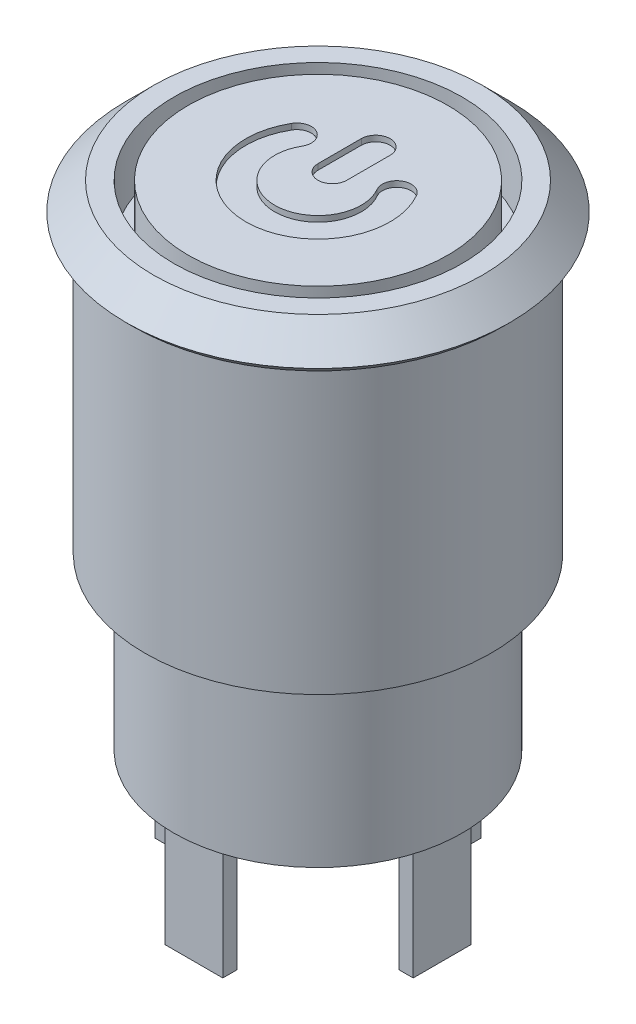
from build123d import *

# Parameters (mm, degrees)
SKETCH_1_R          = 6
EXTRUDE_1_DEPTH     = 10
SKETCH_2_R          = 5.7
SKETCH_3_R          = 6.9
CHAMFER_1_SIZE      = 0.5
CHAMFER_1_SIZE2     = 0.353553391
SKETCH_4_R          = 5
CUT_EXTRUDE_1_DEPTH = 2
SKETCH_5_R          = 4.5
EXTRUDE_2_DEPTH     = 2
CUT_EXTRUDE_2_DEPTH = 0.2
SKETCH_20_R         = 5
EXTRUDE_3_DEPTH     = 5.9
SKETCH_21_W         = 2
SKETCH_21_H         = 0.5
SKETCH_21_W_2       = 2.554126296
SKETCH_21_H_2       = 0.581017117
SKETCH_21_W_3       = 0.5
SKETCH_21_H_3       = 2
SKETCH_21_W_4       = 0.581017117
SKETCH_21_H_4       = 2.554126296
EXTRUDE_4_DEPTH     = 4.2


with BuildPart() as part:
    # 草图1 → 凸台-拉伸1 (new body)
    with BuildSketch(Plane(origin=(0, 0, 0), x_dir=(1, 0, 0), z_dir=(0, 1, 0))):
        with Locations(Location((0, 0, 0), (0, 0, 270))):
            Circle(SKETCH_1_R)
    extrude(amount=EXTRUDE_1_DEPTH)

    # 草图2 → 放样1 section 0
    with BuildSketch(Plane(origin=(0, 11.2, 0), x_dir=(1, 0, 0), z_dir=(0, 1, 0))):
        Circle(SKETCH_2_R)
    # 草图3 → 放样1 section 1
    with BuildSketch(Plane(origin=(0, 10, 0), x_dir=(1, 0, 0), z_dir=(0, 1, 0))):
        Circle(SKETCH_3_R)
    loft()

    # 倒角1
    chamfer_1_edges = [part.edges().sort_by_distance(p)[0] for p in [
        (-6.9, 10, 0),
    ]]
    chamfer_1_side = [part.faces().sort_by_distance(p)[0] for p in [
        (-6.704838528, 10, 0),
    ]]
    chamfer(chamfer_1_edges, length=CHAMFER_1_SIZE, length2=CHAMFER_1_SIZE2, reference=chamfer_1_side[0])

    # 草图4 → 切除-拉伸1 (cut)
    with BuildSketch(Plane(origin=(0, 11.2, 0), x_dir=(1, 0, 0), z_dir=(0, 1, 0))):
        with Locations(Location((0, 0, 0), (0, 0, 270))):
            Circle(SKETCH_4_R)
    extrude(amount=-CUT_EXTRUDE_1_DEPTH, mode=Mode.SUBTRACT)

    # 草图5 → 凸台-拉伸2 (add)
    with BuildSketch(Plane(origin=(0, 9.2, 0), x_dir=(1, 0, 0), z_dir=(0, 1, 0))):
        with Locations(Location((0, 0, 0), (0, 0, 270))):
            Circle(SKETCH_5_R)
    extrude(amount=EXTRUDE_2_DEPTH)

    # 草图6 → 切除-拉伸2 (cut)
    with BuildSketch(Plane(origin=(0, 11.2, 0), x_dir=(1, 0, 0), z_dir=(0, 1, 0))):
        with BuildLine():
            Line((-0.5, 0.5), (-0.5, 2))
            ThreePointArc((-0.5, 2), (0, 2.5), (0.5, 2))
            Line((0.5, 2), (0.5, 0.5))
            ThreePointArc((0.5, 0.5), (0, 0), (-0.5, 0.5))
        make_face()
        with BuildLine():
            ThreePointArc((-2.165063509, 1.25), (0, -2.5), (2.165063509, 1.25))
            ThreePointArc((2.165063509, 1.25), (1.482050808, 1.433012702), (1.299038106, 0.75))
            ThreePointArc((1.299038106, 0.75), (0, -1.5), (-1.299038106, 0.75))
            ThreePointArc((-1.299038106, 0.75), (-1.482050808, 1.433012702), (-2.165063509, 1.25))
        make_face()
    extrude(amount=-CUT_EXTRUDE_2_DEPTH, mode=Mode.SUBTRACT)

    # 草图20 → 凸台-拉伸3 (add)
    with BuildSketch(Plane.XZ):
        with Locations(Location((0, 0, 0), (0, 0, 90))):
            Circle(SKETCH_20_R)
    extrude(amount=EXTRUDE_3_DEPTH)

    # 草图21 → 凸台-拉伸4 (add)
    with BuildSketch(Plane.XZ.offset(5.9)):
        with Locations((0, 4.05)):
            Rectangle(SKETCH_21_W, SKETCH_21_H)
        with Locations((0, -4.090508558)):
            Rectangle(SKETCH_21_W_2, SKETCH_21_H_2)
        with Locations((4.05, 0)):
            Rectangle(SKETCH_21_W_3, SKETCH_21_H_3)
        with Locations((-4.090508558, 0)):
            Rectangle(SKETCH_21_W_4, SKETCH_21_H_4)
    extrude(amount=EXTRUDE_4_DEPTH)


solid = part.part
